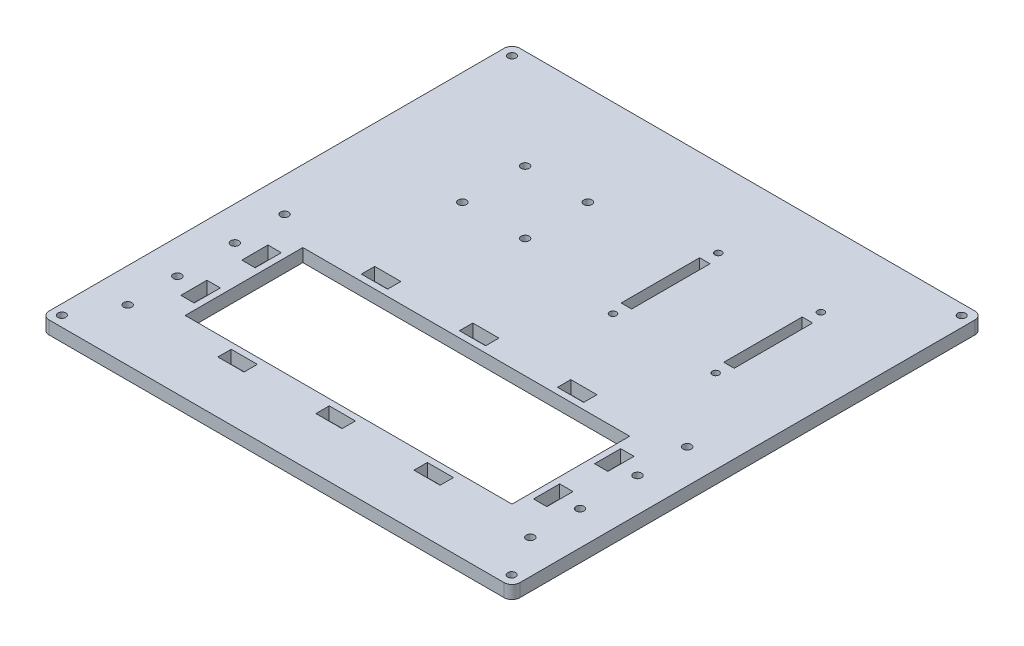
from build123d import *

# Parameters (mm, degrees)
SKETCH1_W           = 180
SKETCH1_H           = 180
SKETCH1_R           = 1.5
BOSS_EXTRUDE1_DEPTH = 5
CUT_EXTRUDE1_REACH  = 129.377
SKETCH4_W           = 5.1
SKETCH4_H           = 10
SKETCH4_W_2         = 10
SKETCH4_H_2         = 5.1
SKETCH4_W_3         = 125
SKETCH4_H_3         = 45
SKETCH5_R           = 1.55
CUT_EXTRUDE3_DEPTH  = 128.377392029
SKETCH6_W           = 4
SKETCH6_H           = 30
SKETCH6_R           = 1.3
CUT_EXTRUDE5_DEPTH  = 10
SKETCH7_R           = 1.55
CUT_EXTRUDE6_DEPTH  = 128.377392029
FILLET1_R           = 3


with BuildPart() as part:
    # Sketch1 → Boss-Extrude1 (new body)
    with BuildSketch(Plane(origin=(0, 0, 0), x_dir=(1, 0, 0), z_dir=(0, 1, 0))):
        Rectangle(SKETCH1_W, SKETCH1_H)
        with Locations(Location((-86, 86, 0), (0, 0, 270))):
            Circle(SKETCH1_R, mode=Mode.SUBTRACT)
        with Locations(Location((86, 86, 0), (0, 0, 270))):
            Circle(SKETCH1_R, mode=Mode.SUBTRACT)
        with Locations(Location((85.840740741, -86, 0), (0, 0, 270))):
            Circle(SKETCH1_R, mode=Mode.SUBTRACT)
        with Locations(Location((-86.159259259, -86, 0), (0, 0, 270))):
            Circle(SKETCH1_R, mode=Mode.SUBTRACT)
    extrude(amount=BOSS_EXTRUDE1_DEPTH)

    # Sketch4 → Cut-Extrude1 (cut, up to next)
    with BuildSketch(Plane(origin=(0, 5, 0), x_dir=(1, 0, 0), z_dir=(0, 1, 0)), mode=Mode.PRIVATE) as cut_extrude1_sk1:
        with Locations((67.45, -28.333333333)):
            Rectangle(SKETCH4_W, SKETCH4_H)
    cut_extrude1_tool1 = extrude(cut_extrude1_sk1.sketch, amount=-CUT_EXTRUDE1_REACH, mode=Mode.PRIVATE) & part.part
    # Sketch4 → Cut-Extrude1 (cut, up to next)
    with BuildSketch(Plane(origin=(0, 5, 0), x_dir=(1, 0, 0), z_dir=(0, 1, 0)), mode=Mode.PRIVATE) as cut_extrude1_sk2:
        with Locations((37.5, -12.55)):
            Rectangle(SKETCH4_W_2, SKETCH4_H_2)
    cut_extrude1_tool2 = extrude(cut_extrude1_sk2.sketch, amount=-CUT_EXTRUDE1_REACH, mode=Mode.PRIVATE) & part.part
    # Sketch4 → Cut-Extrude1 (cut, up to next)
    with BuildSketch(Plane(origin=(0, 5, 0), x_dir=(1, 0, 0), z_dir=(0, 1, 0)), mode=Mode.PRIVATE) as cut_extrude1_sk3:
        with Locations((0, -12.55)):
            Rectangle(SKETCH4_W_2, SKETCH4_H_2)
    cut_extrude1_tool3 = extrude(cut_extrude1_sk3.sketch, amount=-CUT_EXTRUDE1_REACH, mode=Mode.PRIVATE) & part.part
    # Sketch4 → Cut-Extrude1 (cut, up to next)
    with BuildSketch(Plane(origin=(0, 5, 0), x_dir=(1, 0, 0), z_dir=(0, 1, 0)), mode=Mode.PRIVATE) as cut_extrude1_sk4:
        with Locations((-37.5, -12.55)):
            Rectangle(SKETCH4_W_2, SKETCH4_H_2)
    cut_extrude1_tool4 = extrude(cut_extrude1_sk4.sketch, amount=-CUT_EXTRUDE1_REACH, mode=Mode.PRIVATE) & part.part
    # Sketch4 → Cut-Extrude1 (cut, up to next)
    with BuildSketch(Plane(origin=(0, 5, 0), x_dir=(1, 0, 0), z_dir=(0, 1, 0)), mode=Mode.PRIVATE) as cut_extrude1_sk5:
        with Locations((-67.45, -28.333333333)):
            Rectangle(SKETCH4_W, SKETCH4_H)
    cut_extrude1_tool5 = extrude(cut_extrude1_sk5.sketch, amount=-CUT_EXTRUDE1_REACH, mode=Mode.PRIVATE) & part.part
    # Sketch4 → Cut-Extrude1 (cut, up to next)
    with BuildSketch(Plane(origin=(0, 5, 0), x_dir=(1, 0, 0), z_dir=(0, 1, 0)), mode=Mode.PRIVATE) as cut_extrude1_sk6:
        with Locations((-37.5, -67.45)):
            Rectangle(SKETCH4_W_2, SKETCH4_H_2)
    cut_extrude1_tool6 = extrude(cut_extrude1_sk6.sketch, amount=-CUT_EXTRUDE1_REACH, mode=Mode.PRIVATE) & part.part
    # Sketch4 → Cut-Extrude1 (cut, up to next)
    with BuildSketch(Plane(origin=(0, 5, 0), x_dir=(1, 0, 0), z_dir=(0, 1, 0)), mode=Mode.PRIVATE) as cut_extrude1_sk7:
        with Locations((67.45, -51.666666667)):
            Rectangle(SKETCH4_W, SKETCH4_H)
    cut_extrude1_tool7 = extrude(cut_extrude1_sk7.sketch, amount=-CUT_EXTRUDE1_REACH, mode=Mode.PRIVATE) & part.part
    # Sketch4 → Cut-Extrude1 (cut, up to next)
    with BuildSketch(Plane(origin=(0, 5, 0), x_dir=(1, 0, 0), z_dir=(0, 1, 0)), mode=Mode.PRIVATE) as cut_extrude1_sk8:
        with Locations((37.5, -67.45)):
            Rectangle(SKETCH4_W_2, SKETCH4_H_2)
    cut_extrude1_tool8 = extrude(cut_extrude1_sk8.sketch, amount=-CUT_EXTRUDE1_REACH, mode=Mode.PRIVATE) & part.part
    # Sketch4 → Cut-Extrude1 (cut, up to next)
    with BuildSketch(Plane(origin=(0, 5, 0), x_dir=(1, 0, 0), z_dir=(0, 1, 0)), mode=Mode.PRIVATE) as cut_extrude1_sk9:
        with Locations((0, -67.45)):
            Rectangle(SKETCH4_W_2, SKETCH4_H_2)
    cut_extrude1_tool9 = extrude(cut_extrude1_sk9.sketch, amount=-CUT_EXTRUDE1_REACH, mode=Mode.PRIVATE) & part.part
    # Sketch4 → Cut-Extrude1 (cut, up to next)
    with BuildSketch(Plane(origin=(0, 5, 0), x_dir=(1, 0, 0), z_dir=(0, 1, 0)), mode=Mode.PRIVATE) as cut_extrude1_sk10:
        with Locations((-67.45, -51.666666667)):
            Rectangle(SKETCH4_W, SKETCH4_H)
    cut_extrude1_tool10 = extrude(cut_extrude1_sk10.sketch, amount=-CUT_EXTRUDE1_REACH, mode=Mode.PRIVATE) & part.part
    # Sketch4 → Cut-Extrude1 (cut, up to next)
    with BuildSketch(Plane(origin=(0, 5, 0), x_dir=(1, 0, 0), z_dir=(0, 1, 0)), mode=Mode.PRIVATE) as cut_extrude1_sk11:
        with Locations((0, -40)):
            Rectangle(SKETCH4_W_3, SKETCH4_H_3)
    cut_extrude1_tool11 = extrude(cut_extrude1_sk11.sketch, amount=-CUT_EXTRUDE1_REACH, mode=Mode.PRIVATE) & part.part
    add(cut_extrude1_tool1.solids().sort_by_distance((67.45, 5, 28.333333))[0], mode=Mode.SUBTRACT)
    add(cut_extrude1_tool2.solids().sort_by_distance((37.5, 5, 12.55))[0], mode=Mode.SUBTRACT)
    add(cut_extrude1_tool3.solids().sort_by_distance((0, 5, 12.55))[0], mode=Mode.SUBTRACT)
    add(cut_extrude1_tool4.solids().sort_by_distance((-37.5, 5, 12.55))[0], mode=Mode.SUBTRACT)
    add(cut_extrude1_tool5.solids().sort_by_distance((-67.45, 5, 28.333333))[0], mode=Mode.SUBTRACT)
    add(cut_extrude1_tool6.solids().sort_by_distance((-37.5, 5, 67.45))[0], mode=Mode.SUBTRACT)
    add(cut_extrude1_tool7.solids().sort_by_distance((67.45, 5, 51.666667))[0], mode=Mode.SUBTRACT)
    add(cut_extrude1_tool8.solids().sort_by_distance((37.5, 5, 67.45))[0], mode=Mode.SUBTRACT)
    add(cut_extrude1_tool9.solids().sort_by_distance((0, 5, 67.45))[0], mode=Mode.SUBTRACT)
    add(cut_extrude1_tool10.solids().sort_by_distance((-67.45, 5, 51.666667))[0], mode=Mode.SUBTRACT)
    add(cut_extrude1_tool11.solids().sort_by_distance((0, 5, 40))[0], mode=Mode.SUBTRACT)

    # Sketch5 → Cut-Extrude3 (cut, through all)
    with BuildSketch(Plane(origin=(0, 5, 0), x_dir=(1, 0, 0), z_dir=(0, 1, 0))):
        with Locations(Location((-47, 52, 0), (0, 0, 270))):
            Circle(SKETCH5_R)
        with Locations(Location((-23, 52, 0), (0, 0, 270))):
            Circle(SKETCH5_R)
        with Locations(Location((-23, 28, 0), (0, 0, 270))):
            Circle(SKETCH5_R)
        with Locations(Location((-47, 28, 0), (0, 0, 270))):
            Circle(SKETCH5_R)
    extrude(amount=-CUT_EXTRUDE3_DEPTH, mode=Mode.SUBTRACT)

    # Sketch6 → Cut-Extrude5 (cut)
    with BuildSketch(Plane(origin=(0, 5, 0), x_dir=(1, 0, 0), z_dir=(0, 1, 0))):
        with Locations((18.75, 40)):
            Rectangle(SKETCH6_W, SKETCH6_H)
        with Locations((58, 40)):
            Rectangle(SKETCH6_W, SKETCH6_H)
        with Locations(Location((58, 60.125, 0), (0, 0, 270))):
            Circle(SKETCH6_R)
        with Locations(Location((18.75, 60.125, 0), (0, 0, 270))):
            Circle(SKETCH6_R)
        with Locations(Location((18.75, 19.875, 0), (0, 0, 270))):
            Circle(SKETCH6_R)
        with Locations(Location((58, 19.875, 0), (0, 0, 270))):
            Circle(SKETCH6_R)
    extrude(amount=-CUT_EXTRUDE5_DEPTH, mode=Mode.SUBTRACT)

    # Sketch7 → Cut-Extrude6 (cut, through all)
    with BuildSketch(Plane(origin=(0, 5, 0), x_dir=(1, 0, 0), z_dir=(0, 1, 0))):
        with Locations(Location((-77, -10, 0), (0, 0, 270))):
            Circle(SKETCH7_R)
        with Locations(Location((-77, -29, 0), (0, 0, 270))):
            Circle(SKETCH7_R)
        with Locations(Location((-77, -51, 0), (0, 0, 90))):
            Circle(SKETCH7_R)
        with Locations(Location((-77, -70, 0), (0, 0, 90))):
            Circle(SKETCH7_R)
        with Locations(Location((77, -29, 0), (0, 0, 90))):
            Circle(SKETCH7_R)
        with Locations(Location((77, -10, 0), (0, 0, 90))):
            Circle(SKETCH7_R)
        with Locations(Location((77, -70, 0), (0, 0, 270))):
            Circle(SKETCH7_R)
        with Locations(Location((77, -51, 0), (0, 0, 270))):
            Circle(SKETCH7_R)
    extrude(amount=-CUT_EXTRUDE6_DEPTH, mode=Mode.SUBTRACT)

    # Fillet1
    fillet1_edges = [part.edges().sort_by_distance(p)[0] for p in [
        (-90, 2.5, 90),
        (-90, 2.5, -90),
        (90, 2.5, -90),
        (90, 2.5, 90),
    ]]
    fillet(fillet1_edges, radius=FILLET1_R)


solid = part.part
